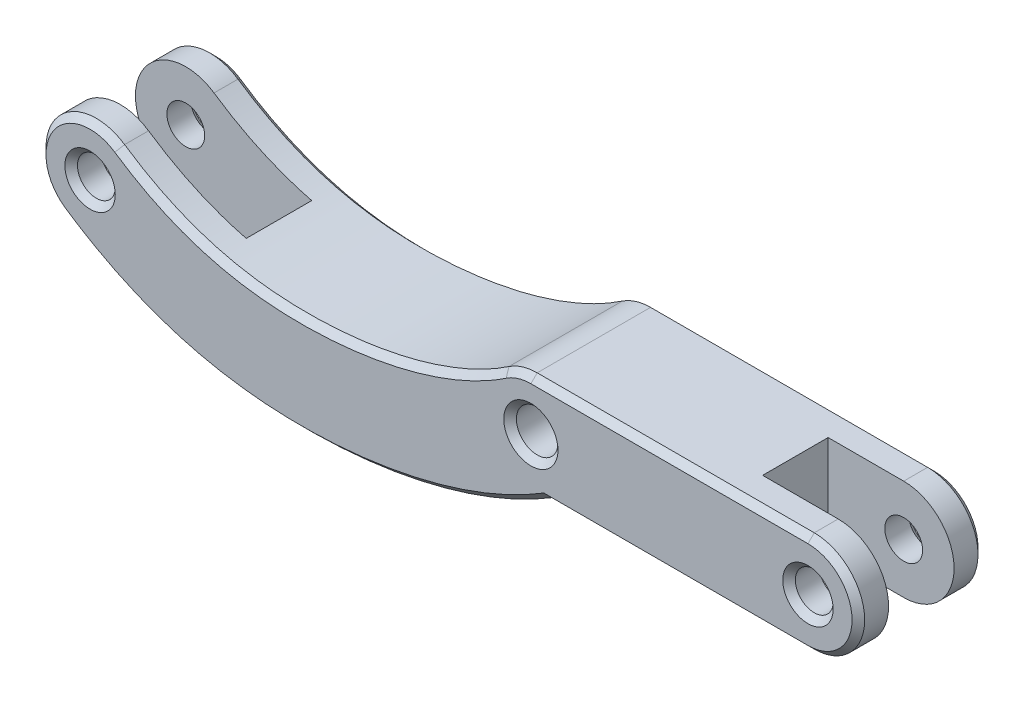
from build123d import *

# Parameters (mm, degrees)
EXTRUDE_1_DEPTH          = 5
EXTRUDE_1_DEPTH_BACK     = 5
SKETCH_1_R               = 4
SKETCH_1_R_2             = 1.5
SKETCH_1_R_3             = 3.999999999999999
SKETCH_1_R_4             = 1.6500000000000021
CUT_EXTRUDE_1_DEPTH      = 2.6
CUT_EXTRUDE_1_DEPTH_BACK = 2.6
SKETCH_2_R               = 10
SKETCH_3_R               = 1.500000000000004
SKETCH_3_R_2             = 1.6500000000000021
EXTRUDE_3_DEPTH          = 10
SKETCH_4_W               = 20.00000000000002
SKETCH_4_H               = 5.2
CUT_EXTRUDE_2_DEPTH      = 10
CHAMFER_1_SIZE           = 0.5


with BuildPart() as part:
    # 草图1 → 凸台-拉伸1 (new, two sides: drawn at the far end of the back side and taken through both)
    # profile 1 of 3: a face of its own
    with BuildSketch(Plane.XY.offset(-EXTRUDE_1_DEPTH_BACK)):
        Circle(SKETCH_1_R)
        Circle(SKETCH_1_R_2, mode=Mode.SUBTRACT)
    # profile 2 of 3: a face of its own
    with BuildSketch(Plane.XY.offset(-EXTRUDE_1_DEPTH_BACK)):
        with BuildLine():
            ThreePointArc((2.241669254584064, 3.3128415224777243), (3.5331768295923327, 1.8752763771860061), (4, 0))
            ThreePointArc((4, -9.8e-16), (1.875276377186004, -3.533176829592334), (-2.241669254584067, -3.312841522477722))
            add(Edge.make_bspline(
                [(-2.2416692545840666, -3.3128415224777275), (4.023288399104954, -7.552091380419048), (17.137885249639094, -10.692937395333647), (31.700941101616845, -7.062033828913657), (37.24166925458407, -3.3128415224777283)],
                knots=[0, 0, 0, 0, 0.5000000000000002, 1, 1, 1, 1], degree=3))
            ThreePointArc((37.24166925458406, -3.312841522477722), (31.687158477522274, -2.2416692545840604), (32.75833074541594, 3.312841522477726))
            add(Edge.make_bspline(
                [(2.2416692545840613, 3.3128415224777203), (2.5417844094553557, 3.1097654287542427), (3.1567145921113204, 2.711097631998411), (4.363329654695279, 1.996321701251651), (5.869996949507693, 1.2242995538785062), (7.677590875082871, 0.4788920232894552), (10.115405251702699, -0.2996699093227729), (13.252057238449053, -0.9025900818361017), (17.317568666800724, -1.0878092080294735), (21.627918427541044, -0.7536952847930135), (25.807284141658094, 0.1095698053821612), (28.992197069652473, 1.2411094397422888), (31.264365551631894, 2.3695049176779595), (32.264190962280374, 2.9784766119300636), (32.75833074541594, 3.312841522477724)],
                knots=[0, 0, 0, 0, 0.03125, 0.0625, 0.125, 0.1875, 0.25, 0.375, 0.5, 0.625, 0.75, 0.875, 0.9375, 1, 1, 1, 1], degree=3))
        make_face()
    # profile 3 of 3: a face of its own
    with BuildSketch(Plane.XY.offset(-EXTRUDE_1_DEPTH_BACK)):
        with Locations((35, 2.24e-15)):
            Circle(SKETCH_1_R_3)
        with Locations((35, 2.24e-15)):
            Circle(SKETCH_1_R_4, mode=Mode.SUBTRACT)
    extrude(amount=EXTRUDE_1_DEPTH + EXTRUDE_1_DEPTH_BACK)

    # 草图2 → 切除-拉伸1 (cut, two sides: drawn at the far end of the back side and taken through both)
    with BuildSketch(Plane.XY.offset(-CUT_EXTRUDE_1_DEPTH_BACK)):
        Circle(SKETCH_2_R)
    extrude(amount=CUT_EXTRUDE_1_DEPTH + CUT_EXTRUDE_1_DEPTH_BACK, mode=Mode.SUBTRACT)

    # 草图3 → 凸台-拉伸3 (add)
    with BuildSketch(Plane(origin=(0, 0, -5), x_dir=(-1, 0, 0), z_dir=(0, 0, -1))):
        with BuildLine():
            Line((-57, 3.9999999999999947), (-35, 4.000000000000001))
            ThreePointArc((-35, 4.000000000000001), (-31.000000000000004, 2.24e-15), (-35, -3.9999999999999956))
            Line((-35, -3.9999999999999956), (-57, -3.9999999999999947))
            ThreePointArc((-57, -3.9999999999999947), (-61, -2.2e-15), (-57, 3.9999999999999947))
        make_face()
        with Locations((-57, -2.69e-15)):
            Circle(SKETCH_3_R, mode=Mode.SUBTRACT)
        with Locations(Location((-35, 2.24e-15, 0), (0, 0, 180))):
            Circle(SKETCH_3_R_2, mode=Mode.SUBTRACT)
    extrude(amount=-EXTRUDE_3_DEPTH)

    # 草图4 → 切除-拉伸2 (cut)
    with BuildSketch(Plane(origin=(1.1e-15, 4.000000000000011, 0), x_dir=(1, -2.8e-16, 0), z_dir=(2.8e-16, 1, 0))):
        with Locations((61.000000000000014, 0)):
            Rectangle(SKETCH_4_W, SKETCH_4_H)
    extrude(amount=-CUT_EXTRUDE_2_DEPTH, mode=Mode.SUBTRACT)

    # 倒角1
    chamfer_1_edges = [part.edges().sort_by_distance(p)[0] for p in [
        (58.50000000000001, -2.51e-15, -5),
        (58.50000000000001, -2.51e-15, 5),
        (33.349999999999994, 1.71e-15, 5),
        (-1.5, 1.8e-16, 5),
        (-1.5, 1.8e-16, -5),
        (33.349999999999994, 1.71e-15, -5),
        (17.466337621201156, -0.999163570519443, 5),
        (-3.3128415224777235, 2.2416692545840653, 5),
        (17.466337621201156, -0.999163570519443, 5),
        (46.58588320296925, -3.999999999999995, 5),
        (46.58588320296925, -3.999999999999995, -5),
        (33.82768734757124, 3.824353938243094, 5),
        (61, -2e-17, -5),
        (61, -2e-17, 5),
        (46, 3.999999999999998, -5),
        (46, 3.999999999999998, 5),
        (17.466337621201156, -0.999163570519443, -5),
        (-3.3128415224777235, 2.2416692545840653, -5),
        (33.82768734757124, 3.8243539382430947, -5),
        (17.466337621201156, -0.999163570519443, -5),
    ]]
    chamfer(chamfer_1_edges, length=CHAMFER_1_SIZE)


solid = part.part
